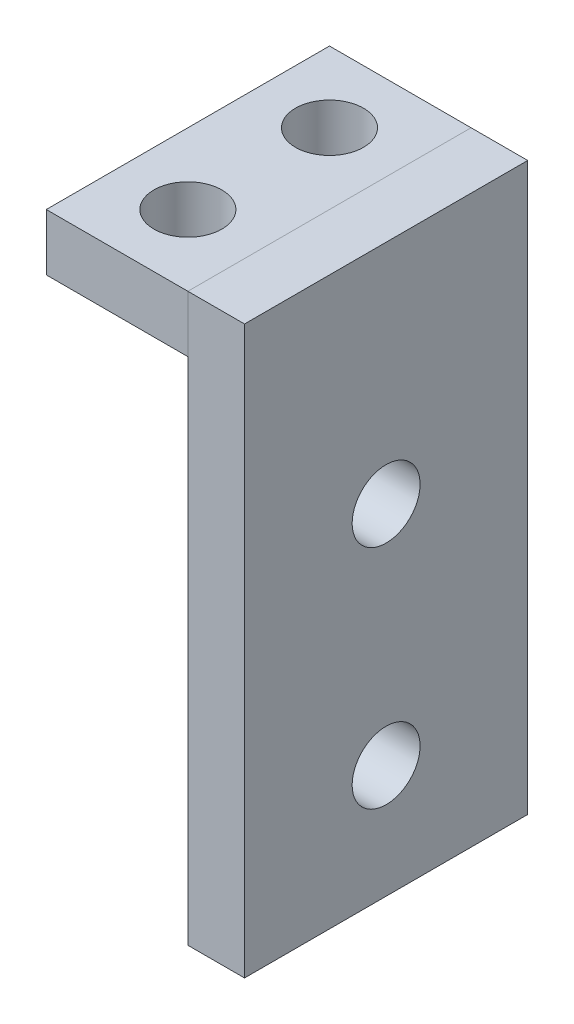
from build123d import *

# Parameters (mm, degrees)
SKETCH1_W           = 6.35
SKETCH1_H           = 12.7
SKETCH1_R           = 1.524
BOSS_EXTRUDE1_DEPTH = 2.54
SKETCH3_W           = 2.54
SKETCH3_H           = 12.7
BOSS_EXTRUDE3_DEPTH = 25.4
SKETCH4_R           = 1.524
CUT_EXTRUDE1_DEPTH  = 27.910817528


with BuildPart() as part:
    # Sketch1 → Boss-Extrude1 (new body)
    with BuildSketch(Plane(origin=(0, 0, 0), x_dir=(1, 0, 0), z_dir=(0, 1, 0))):
        with Locations((3.175, 6.35)):
            Rectangle(SKETCH1_W, SKETCH1_H)
        with Locations(Location((3.175, 3.175, 0), (0, 0, 270))):
            Circle(SKETCH1_R, mode=Mode.SUBTRACT)
        with Locations(Location((3.175, 9.525, 0), (0, 0, 270))):
            Circle(SKETCH1_R, mode=Mode.SUBTRACT)
    extrude(amount=BOSS_EXTRUDE1_DEPTH)


with BuildPart() as body_2:
    # Sketch3 → Boss-Extrude3 (new body)
    with BuildSketch(Plane(origin=(0, 2.54, 0), x_dir=(1, 0, 0), z_dir=(0, 1, 0))):
        with Locations((7.62, 6.35)):
            Rectangle(SKETCH3_W, SKETCH3_H)
    extrude(amount=-BOSS_EXTRUDE3_DEPTH)

    # Sketch4 → Cut-Extrude1 (cut, through all)
    with BuildSketch(Plane.ZY.offset(-6.35)):
        with Locations((-6.35, -7.62)):
            Circle(SKETCH4_R)
        with Locations((-6.35, -17.78)):
            Circle(SKETCH4_R)
    extrude(amount=-CUT_EXTRUDE1_DEPTH, mode=Mode.SUBTRACT)


solid = Compound([part.part, body_2.part])
